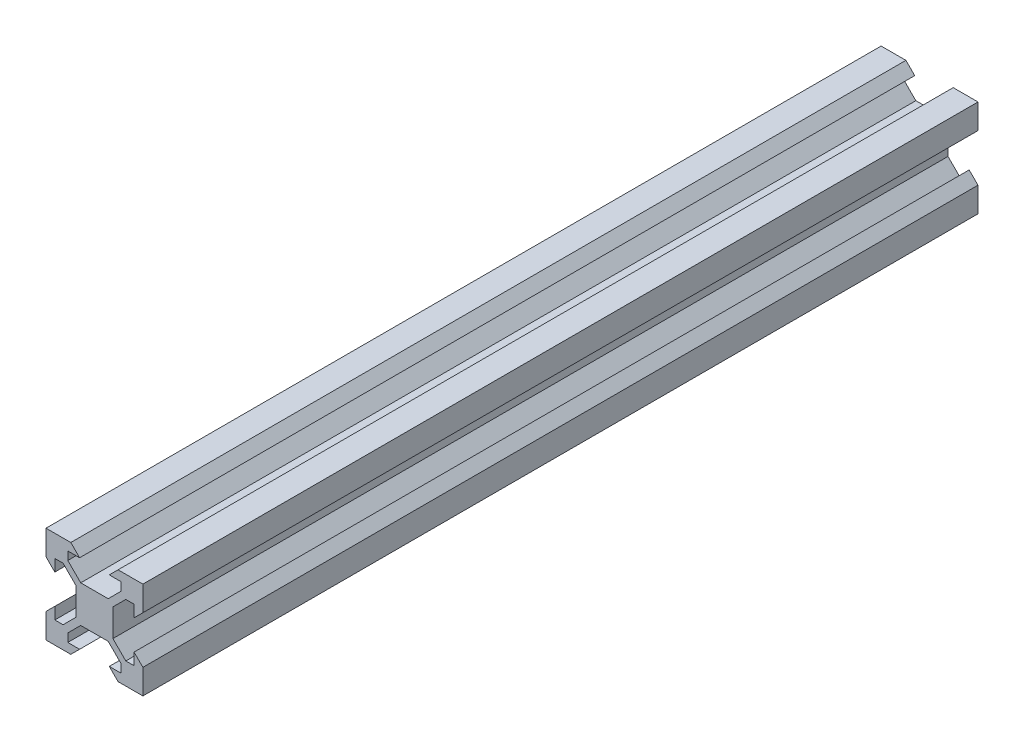
from build123d import *

# Parameters (mm, degrees)
SKETCH1_W           = 20
SKETCH1_H           = 20
BOSS_EXTRUDE1_DEPTH = 172.4
CUT_EXTRUDE1_DEPTH  = 175.704779557


with BuildPart() as part:
    # Sketch1 → Boss-Extrude1 (new body)
    with BuildSketch(Plane.XY):
        with Locations((10, 10)):
            Rectangle(SKETCH1_W, SKETCH1_H)
    extrude(amount=BOSS_EXTRUDE1_DEPTH)

    # Sketch2 → Cut-Extrude1 (cut, through all)
    with BuildSketch(Plane.XY.offset(172.4)):
        Polygon((4.5, 18.18), (6.94, 18.18), (5.12, 20), (14.88, 20), (13.06, 18.18), (15.5, 18.18), (15.5, 16.475807358), (12.834192642, 13.81), (7.165807358, 13.81), (4.5, 16.475807358), align=None)
        Polygon((14.88, 0), (13.06, 1.82), (15.5, 1.82), (15.5, 3.524192642), (12.834192642, 6.19), (7.165807358, 6.19), (4.5, 3.524192642), (4.5, 1.82), (6.94, 1.82), (5.12, 0), align=None)
        Polygon((1.82, 4.5), (1.82, 6.94), (0, 5.12), (0, 14.88), (1.82, 13.06), (1.82, 15.5), (3.524192642, 15.5), (6.19, 12.834192642), (6.19, 7.165807358), (3.524192642, 4.5), align=None)
        Polygon((20, 14.88), (18.18, 13.06), (18.18, 15.5), (16.475807358, 15.5), (13.81, 12.834192642), (13.81, 7.165807358), (16.475807358, 4.5), (18.18, 4.5), (18.18, 6.94), (20, 5.12), align=None)
    extrude(amount=-CUT_EXTRUDE1_DEPTH, mode=Mode.SUBTRACT)


solid = part.part
